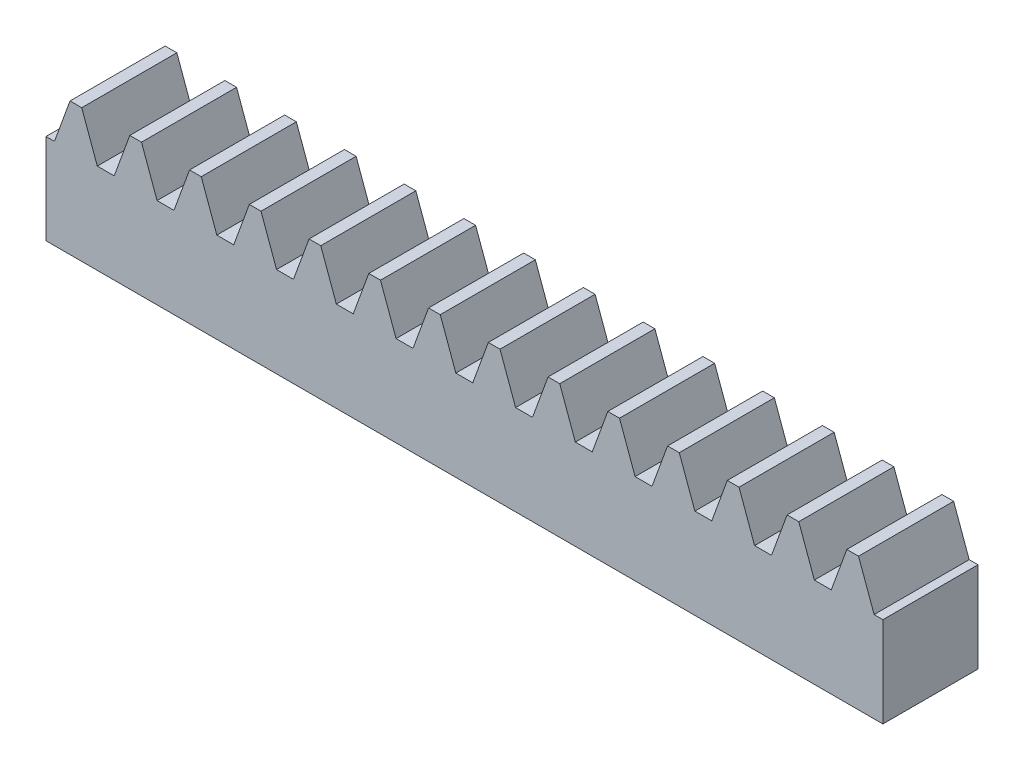
from build123d import *

# Parameters (mm, degrees)
BLANKSKE_W        = 44
BLANKSKE_H        = 7
BLANK_DEPTH       = 5
TOOTHCUTSIM_DEPTH = 45.833023543
TEETHCUTS_COUNT   = 33
TEETHCUTS_PITCH   = 3.14159265


with BuildPart() as part:
    # BlankSke → Blank (new body)
    with BuildSketch(Plane.XY):
        with Locations((22, 3.5)):
            Rectangle(BLANKSKE_W, BLANKSKE_H)
    extrude(amount=-BLANK_DEPTH)

    # TooCutSkeSim → ToothCutSim (cut, through all)
    with BuildSketch(Plane.XY):
        Polygon((0.44443537, 4.75), (-0.44443537, 4.75), (-1.272613241, 7.0254), (1.272613241, 7.0254), align=None)
    toothcutsim = extrude(amount=-TOOTHCUTSIM_DEPTH, mode=Mode.SUBTRACT)

    # TeethCuts: ToothCutSim ×33
    with Locations(*[(i * TEETHCUTS_PITCH, 0, 0) for i in range(1, TEETHCUTS_COUNT)]):
        add(toothcutsim, mode=Mode.SUBTRACT)


solid = part.part
